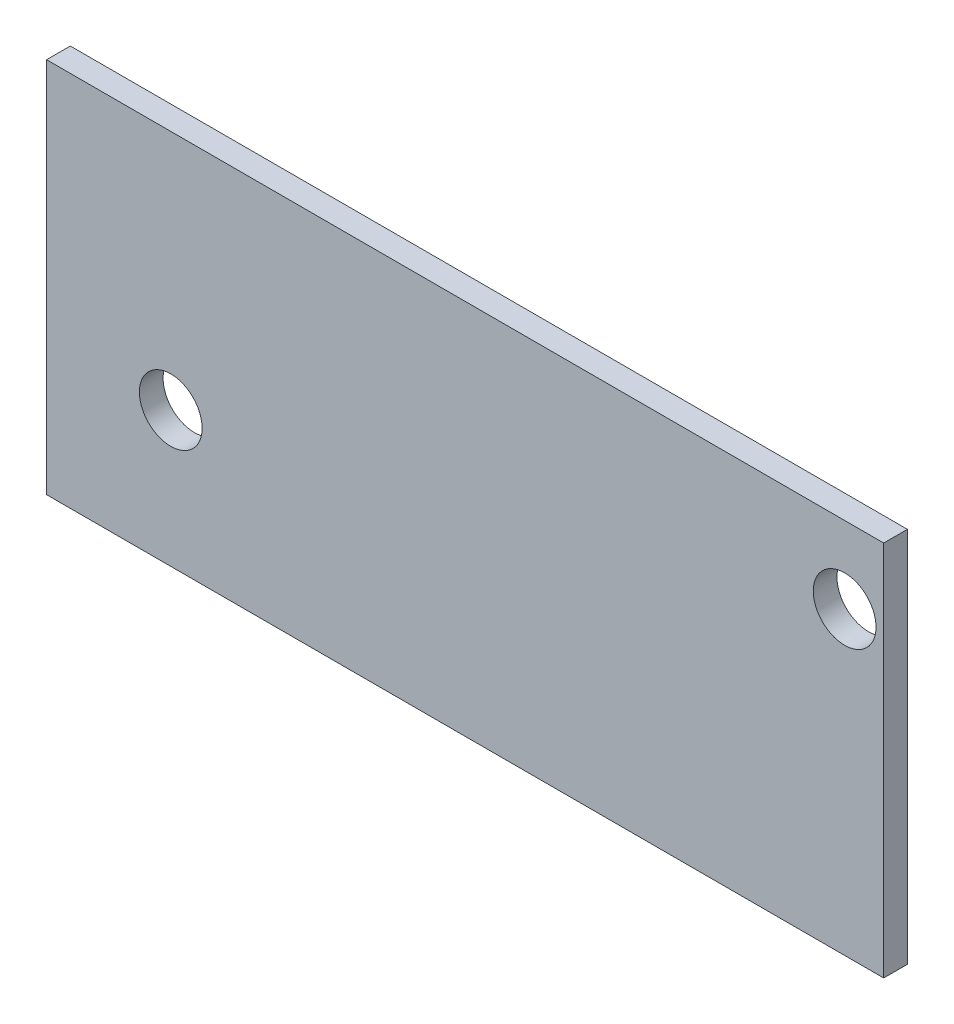
from build123d import *

# Parameters (mm, degrees)
SKETCH1_W           = 60
SKETCH1_H           = 27
BOSS_EXTRUDE1_DEPTH = 1.7
SKETCH2_R           = 2.25
CUT_EXTRUDE1_DEPTH  = 10


with BuildPart() as part:
    # Sketch1 → Boss-Extrude1 (new body)
    with BuildSketch(Plane.XY):
        with Locations((27.80104712, 43.201570681)):
            Rectangle(SKETCH1_W, SKETCH1_H)
    extrude(amount=BOSS_EXTRUDE1_DEPTH)

    # Sketch2 → Cut-Extrude1 (cut)
    with BuildSketch(Plane(origin=(0, 0, 0), x_dir=(-1, 0, 0), z_dir=(0, 0, -1))):
        with Locations((-55.001556495, 51.202231931)):
            Circle(SKETCH2_R)
        with Locations((-6.701556495, 39.402231931)):
            Circle(SKETCH2_R)
    extrude(amount=-CUT_EXTRUDE1_DEPTH, mode=Mode.SUBTRACT)


solid = part.part
